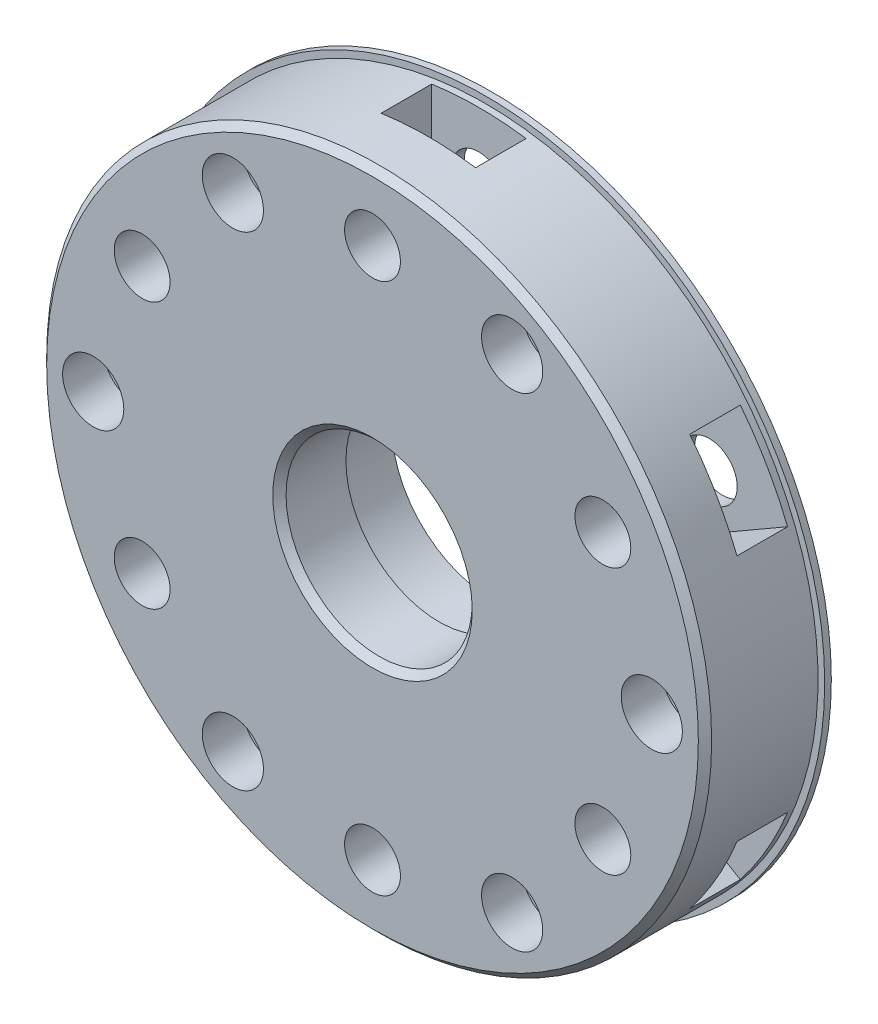
from build123d import *

# Parameters (mm, degrees)
OUTPUT_MASTER_SKETCH_R  = 25
BOSS_EXTRUDE1_DEPTH     = 9
SKETCH4_R               = 3.05
CUT_EXTRUDE1_DEPTH      = 4
SKETCH5_R               = 25.5
SKETCH5_R_2             = 25
BOSS_EXTRUDE2_DEPTH     = 0.5
SKETCH6_R               = 1.55
CUT_EXTRUDE2_DEPTH      = 38.16853508
SKETCH7_R               = 2.3
CUT_EXTRUDE3_DEPTH      = 3.1
CHAMFER1_SIZE           = 0.5
SKETCH8_R               = 7
CUT_EXTRUDE4_DEPTH      = 10
SKETCH9_R               = 7.55
CUT_EXTRUDE5_DEPTH      = 4
SKETCH10_R              = 2.1
M4_THRU_DEPTH           = 38.16853508
CHAMFER3_SIZE           = 0.5
M4_START                = -8
M4_HEXNUT_CUT_DEPTH     = 3.8
SKETCH12_W              = 7.1
SKETCH12_H              = 3.8
M4_HEXNUT_SLOT_DEPTH    = 55.701131961
M4_HEXNUT_PATTERN_COUNT = 6


with BuildPart() as part:
    # Output Master Sketch → Boss-Extrude1 (new body)
    with BuildSketch(Plane.XY):
        Circle(OUTPUT_MASTER_SKETCH_R)
    extrude(amount=BOSS_EXTRUDE1_DEPTH)

    # Sketch4 → Cut-Extrude1 (cut)
    with BuildSketch(Plane.XY):
        with Locations((21, 0)):
            Circle(SKETCH4_R)
        with Locations((10.5, -18.186533479)):
            Circle(SKETCH4_R)
        with Locations((-10.5, -18.186533479)):
            Circle(SKETCH4_R)
        with Locations((-21, 0)):
            Circle(SKETCH4_R)
        with Locations((-10.5, 18.186533479)):
            Circle(SKETCH4_R)
        with Locations((10.5, 18.186533479)):
            Circle(SKETCH4_R)
    extrude(amount=CUT_EXTRUDE1_DEPTH, mode=Mode.SUBTRACT)

    # Sketch5 → Boss-Extrude2 (add)
    with BuildSketch(Plane(origin=(0, 0, 0), x_dir=(-1, 0, 0), z_dir=(0, 0, -1))):
        Circle(SKETCH5_R)
        Circle(SKETCH5_R_2, mode=Mode.SUBTRACT)
    extrude(amount=-BOSS_EXTRUDE2_DEPTH)

    # Sketch6 → Cut-Extrude2 (cut, through all)
    with BuildSketch(Plane(origin=(0, 0, 0), x_dir=(-1, 0, 0), z_dir=(0, 0, -1))):
        with Locations((-21, 0)):
            Circle(SKETCH6_R)
        with Locations((-10.5, 18.186533479)):
            Circle(SKETCH6_R)
        with Locations((10.5, 18.186533479)):
            Circle(SKETCH6_R)
        with Locations((21, 0)):
            Circle(SKETCH6_R)
        with Locations((10.5, -18.186533479)):
            Circle(SKETCH6_R)
        with Locations((-10.5, -18.186533479)):
            Circle(SKETCH6_R)
    extrude(amount=-CUT_EXTRUDE2_DEPTH, mode=Mode.SUBTRACT)

    # Sketch7 → Cut-Extrude3 (cut)
    with BuildSketch(Plane.XY.offset(9)):
        with Locations((-21, 0)):
            Circle(SKETCH7_R)
        with Locations((-10.5, 18.186533479)):
            Circle(SKETCH7_R)
        with Locations((10.5, 18.186533479)):
            Circle(SKETCH7_R)
        with Locations((21, 0)):
            Circle(SKETCH7_R)
        with Locations((10.5, -18.186533479)):
            Circle(SKETCH7_R)
        with Locations((-10.5, -18.186533479)):
            Circle(SKETCH7_R)
    extrude(amount=-CUT_EXTRUDE3_DEPTH, mode=Mode.SUBTRACT)

    # Chamfer1
    chamfer1_edges = [part.edges().sort_by_distance(p)[0] for p in [
        (-25, 0, 9),
    ]]
    chamfer(chamfer1_edges, length=CHAMFER1_SIZE)

    # Sketch8 → Cut-Extrude4 (cut)
    with BuildSketch(Plane(origin=(0, 0, 0), x_dir=(-1, 0, 0), z_dir=(0, 0, -1))):
        Circle(SKETCH8_R)
    extrude(amount=-CUT_EXTRUDE4_DEPTH, mode=Mode.SUBTRACT)

    # Sketch9 → Cut-Extrude5 (cut)
    with BuildSketch(Plane(origin=(0, 0, 0), x_dir=(-1, 0, 0), z_dir=(0, 0, -1))):
        Circle(SKETCH9_R)
    extrude(amount=-CUT_EXTRUDE5_DEPTH, mode=Mode.SUBTRACT)

    # Sketch10 → M4 Thru (cut, through all)
    with BuildSketch(Plane.XY.offset(9)):
        with Locations((0, 20)):
            Circle(SKETCH10_R)
        with Locations((17.320508076, 10)):
            Circle(SKETCH10_R)
        with Locations((17.320508076, -10)):
            Circle(SKETCH10_R)
        with Locations((0, -20)):
            Circle(SKETCH10_R)
        with Locations((-17.320508076, -10)):
            Circle(SKETCH10_R)
        with Locations((-17.320508076, 10)):
            Circle(SKETCH10_R)
    extrude(amount=-M4_THRU_DEPTH, mode=Mode.SUBTRACT)

    # Chamfer3
    chamfer3_edges = [part.edges().sort_by_distance(p)[0] for p in [
        (7, 0, 9),
    ]]
    chamfer(chamfer3_edges, length=CHAMFER3_SIZE)

    # Sketch11 → M4 Hexnut Cut (cut)
    with BuildSketch(Plane.XY.offset(9).offset(M4_START)):
        Polygon((0, 24.099186911), (-3.55, 22.049593456), (-3.55, 17.950406544), (0, 15.900813089), (3.55, 17.950406544), (3.55, 22.049593456), align=None)
    m4_hexnut_cut = extrude(amount=M4_HEXNUT_CUT_DEPTH, mode=Mode.SUBTRACT)

    # Sketch12 → M4 Hexnut Slot (cut, through all)
    with BuildSketch(Plane(origin=(0, 22.049593456, 0), x_dir=(1, 0, 0), z_dir=(0, 1, 0))):
        with Locations((0, -2.9)):
            Rectangle(SKETCH12_W, SKETCH12_H)
    m4_hexnut_slot = extrude(amount=M4_HEXNUT_SLOT_DEPTH, mode=Mode.SUBTRACT)

    # M4 Hexnut Pattern: M4 Hexnut Cut, M4 Hexnut Slot ×6 about axis
    m4_hexnut_pattern_axis = Axis((0, 0, 0), (0, 0, 1))
    add([m4_hexnut_cut.rotate(m4_hexnut_pattern_axis, i * 360 / M4_HEXNUT_PATTERN_COUNT) for i in range(1, M4_HEXNUT_PATTERN_COUNT)], mode=Mode.SUBTRACT)
    add([m4_hexnut_slot.rotate(m4_hexnut_pattern_axis, i * 360 / M4_HEXNUT_PATTERN_COUNT) for i in range(1, M4_HEXNUT_PATTERN_COUNT)], mode=Mode.SUBTRACT)


solid = part.part
